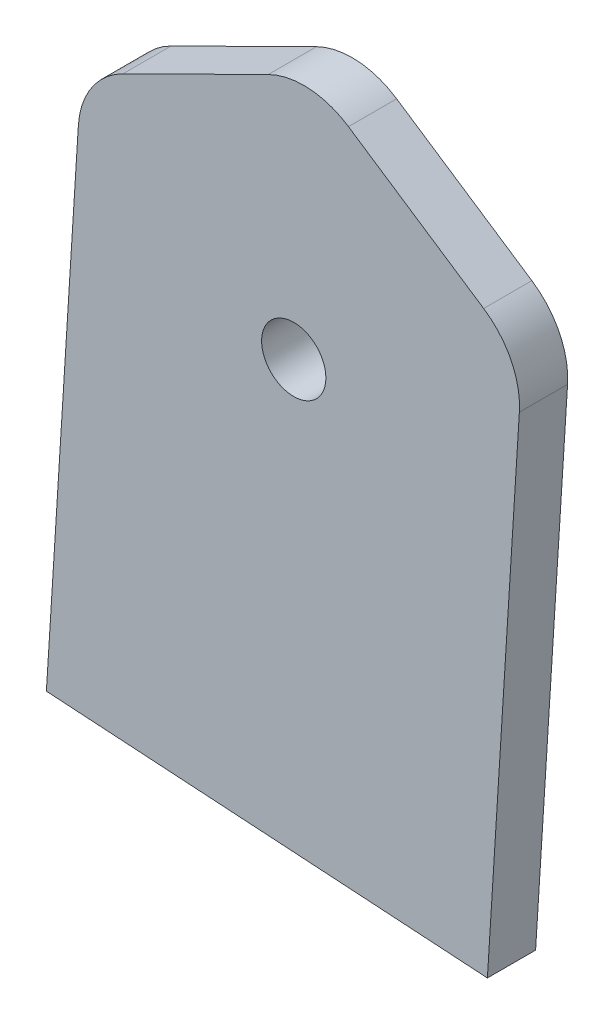
from build123d import *

# Parameters (mm, degrees)
SKETCH1_R           = 4
BOSS_EXTRUDE1_DEPTH = 6


with BuildPart() as part:
    # Sketch1 → Boss-Extrude1 (new body)
    with BuildSketch(Plane.XY):
        with BuildLine():
            Line((-175.713175714, 296.79199868), (-157.610812193, 305.771718277))
            ThreePointArc((-157.610812193, 305.771718277), (-152.536266436, 306.793434775), (-147.630722648, 305.14099434))
            Line((-147.630722648, 305.14099434), (-130.802875598, 293.95374746))
            ThreePointArc((-130.802875598, 293.95374746), (-127.380770276, 290.069920171), (-126.359053778, 284.995374414))
            Line((-126.359053778, 284.995374414), (-130.339131129, 222.017697485))
            Line((-130.339131129, 222.017697485), (-185.22952079, 225.486672642))
            Line((-185.22952079, 225.486672642), (-181.249443439, 288.464349571))
            ThreePointArc((-181.249443439, 288.464349571), (-179.597003003, 293.369893358), (-175.713175714, 296.79199868))
        make_face()
        with Locations((-154.441734867, 276.643587511)):
            Circle(SKETCH1_R, mode=Mode.SUBTRACT)
    extrude(amount=BOSS_EXTRUDE1_DEPTH)


solid = part.part
